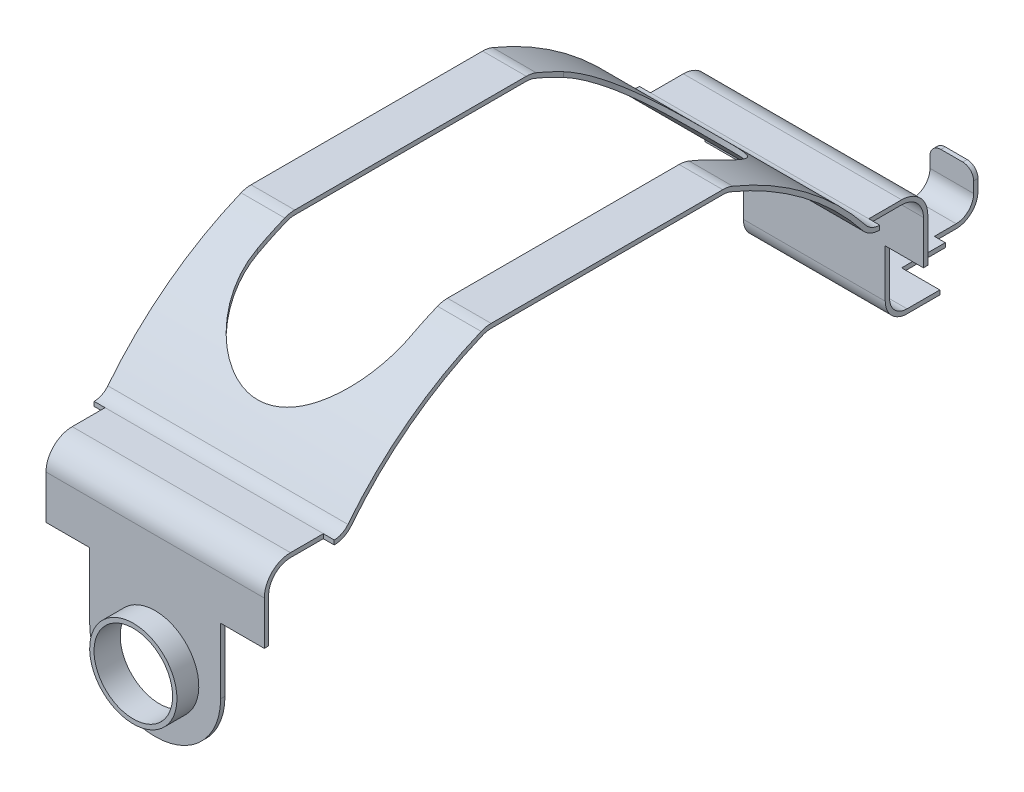
from build123d import *

# Parameters (mm, degrees)
EXTRUDE1_DEPTH     = 2.75
CUT_EXTRUDE1_DEPTH = 15.329956996
EXTRUDE2_DEPTH     = 2.5
EXTRUDE3_DEPTH     = 1.625
SKETCH8_W          = 1
SKETCH8_H          = 0.1
EXTRUDE4_DEPTH     = 0.75
EXTRUDE5_DEPTH     = 0.5
EXTRUDE6_DEPTH     = 0.1
SKETCH11_R         = 1
SKETCH11_R_2       = 0.9
EXTRUDE7_DEPTH     = 0.5
CUT_EXTRUDE2_REACH = 24.429
SKETCH12_R         = 0.9
FILLET1_R          = 0.25


with BuildPart() as part:
    # Sketch4 → Extrude1 (new, symmetric)
    with BuildSketch(Plane(origin=(0, 0, 0), x_dir=(0, 0, -1), z_dir=(1, 0, 0))):
        with BuildLine():
            Line((-2.652797108, 12.6), (2.652797108, 12.6))
            ThreePointArc((2.652797108, 12.6), (2.769316269, 12.58857734), (2.8813989, 12.554744284))
            ThreePointArc((2.8813989, 12.554744284), (4.555213838, 11.599383852), (5.933197614, 10.251967541))
            ThreePointArc((5.933197614, 10.251967541), (6.072675346, 10.139990984), (6.247012686, 10.1))
            Line((6.247012686, 10.1), (6.247012686, 10))
            ThreePointArc((6.247012686, 10), (6.029091011, 10.04998873), (5.854743846, 10.189959426))
            ThreePointArc((5.854743846, 10.189959426), (4.494980939, 11.519559057), (2.843298601, 12.462286904))
            ThreePointArc((2.843298601, 12.462286904), (2.749896409, 12.490481117), (2.652797108, 12.5))
            Line((2.652797108, 12.5), (-2.652797108, 12.5))
            ThreePointArc((-2.652797108, 12.5), (-2.749896409, 12.490481117), (-2.843298601, 12.462286904))
            ThreePointArc((-2.843298601, 12.462286904), (-4.494980939, 11.519559057), (-5.854743846, 10.189959426))
            ThreePointArc((-5.854743846, 10.189959426), (-6.029091011, 10.04998873), (-6.247012686, 10))
            Line((-6.247012686, 10), (-6.247012686, 10.1))
            ThreePointArc((-6.247012686, 10.1), (-6.072675346, 10.139990984), (-5.933197614, 10.251967541))
            ThreePointArc((-5.933197614, 10.251967541), (-4.555213838, 11.599383852), (-2.8813989, 12.554744284))
            ThreePointArc((-2.8813989, 12.554744284), (-2.769316269, 12.58857734), (-2.652797108, 12.6))
        make_face()
    extrude(amount=EXTRUDE1_DEPTH, both=True)

    # Sketch5 → Cut-Extrude1 (cut, through all)
    with BuildSketch(Plane(origin=(0, 0, 0), x_dir=(1, 0, 0), z_dir=(0, 1, 0))):
        with BuildLine():
            Line((1.75, -3.5), (1.75, 3.5))
            ThreePointArc((1.75, 3.5), (0, 5.25), (-1.75, 3.5))
            Line((-1.75, 3.5), (-1.75, -3.5))
            ThreePointArc((-1.75, -3.5), (0, -5.25), (1.75, -3.5))
        make_face()
    extrude(amount=CUT_EXTRUDE1_DEPTH, mode=Mode.SUBTRACT)

    # Sketch6 → Extrude2 (add, symmetric)
    with BuildSketch(Plane(origin=(0, 0, 0), x_dir=(0, 0, -1), z_dir=(1, 0, 0))):
        with BuildLine():
            Line((6.247012686, 10), (7, 10))
            ThreePointArc((7, 10), (7.353553391, 9.853553391), (7.5, 9.5))
            Line((7.5, 9.5), (7.5, 8.5))
            Line((7.5, 8.5), (7.6, 8.5))
            Line((7.6, 8.5), (7.6, 9.5))
            ThreePointArc((7.6, 9.5), (7.424264069, 9.924264069), (7, 10.1))
            Line((7, 10.1), (6.247012686, 10.1))
            Line((6.247012686, 10.1), (6.247012686, 10))
        make_face()
        with BuildLine():
            Line((-7.5, 8.5), (-7.6, 8.5))
            Line((-7.6, 8.5), (-7.6, 9.5))
            ThreePointArc((-7.6, 9.5), (-7.424264069, 9.924264069), (-7, 10.1))
            Line((-7, 10.1), (-6.247012686, 10.1))
            Line((-6.247012686, 10.1), (-6.247012686, 10))
            Line((-6.247012686, 10), (-7, 10))
            ThreePointArc((-7, 10), (-7.353553391, 9.853553391), (-7.5, 9.5))
            Line((-7.5, 9.5), (-7.5, 8.5))
        make_face()
    extrude(amount=EXTRUDE2_DEPTH, both=True)

    # Sketch7 → Extrude3 (add, symmetric)
    with BuildSketch(Plane(origin=(0, 0, 0), x_dir=(0, 0, -1), z_dir=(1, 0, 0))):
        with BuildLine():
            Line((7.5, 8.5), (7.5, 7.4))
            ThreePointArc((7.5, 7.4), (7.646446609, 7.046446609), (8, 6.9))
            Line((8, 6.9), (8.75, 6.9))
            Line((8.75, 6.9), (8.75, 7))
            Line((8.75, 7), (8, 7))
            ThreePointArc((8, 7), (7.717157288, 7.117157288), (7.6, 7.4))
            Line((7.6, 7.4), (7.6, 8.5))
            Line((7.6, 8.5), (7.5, 8.5))
        make_face()
    extrude(amount=EXTRUDE3_DEPTH, both=True)

    # Sketch8 → Extrude4 (add, symmetric)
    with BuildSketch(Plane(origin=(0, 0, 0), x_dir=(0, 0, -1), z_dir=(1, 0, 0))):
        with Locations((9.25, 6.95)):
            Rectangle(SKETCH8_W, SKETCH8_H)
    extrude(amount=EXTRUDE4_DEPTH, both=True)

    # Sketch9 → Extrude5 (add, symmetric)
    with BuildSketch(Plane(origin=(0, 0, 0), x_dir=(0, 0, -1), z_dir=(1, 0, 0))):
        with BuildLine():
            Line((10.75, 7.4), (10.75, 7.9))
            Line((10.75, 7.9), (10.65, 7.9))
            Line((10.65, 7.9), (10.65, 7.4))
            ThreePointArc((10.65, 7.4), (10.532842712, 7.117157288), (10.25, 7))
            Line((10.25, 7), (9.75, 7))
            Line((9.75, 7), (9.75, 6.9))
            Line((9.75, 6.9), (10.25, 6.9))
            ThreePointArc((10.25, 6.9), (10.603553391, 7.046446609), (10.75, 7.4))
        make_face()
    extrude(amount=EXTRUDE5_DEPTH, both=True)

    # Sketch10 → Extrude6 (add)
    with BuildSketch(Plane.XY.offset(7.5)):
        with BuildLine():
            Line((-1.5, 8.5), (-1.5, 7))
            ThreePointArc((-1.5, 7), (0, 5.5), (1.5, 7))
            Line((1.5, 7), (1.5, 8.5))
            Line((1.5, 8.5), (-1.5, 8.5))
        make_face()
    extrude(amount=EXTRUDE6_DEPTH)

    # Sketch11 → Extrude7 (add)
    with BuildSketch(Plane.XY.offset(7.6)):
        with Locations(Location((0, 7, 0), (0, 0, 90))):
            Circle(SKETCH11_R)
        with Locations((0, 7)):
            Circle(SKETCH11_R_2, mode=Mode.SUBTRACT)
    extrude(amount=EXTRUDE7_DEPTH)

    # Sketch12 → Cut-Extrude2 (cut, up to next)
    with BuildSketch(Plane.XY.offset(7.6), mode=Mode.PRIVATE) as cut_extrude2_sk1:
        with Locations((0, 7)):
            Circle(SKETCH12_R)
    cut_extrude2_tool1 = extrude(cut_extrude2_sk1.sketch, amount=-CUT_EXTRUDE2_REACH, mode=Mode.PRIVATE) & part.part
    add(cut_extrude2_tool1.solids().sort_by_distance((0, 7, 7.6))[0], mode=Mode.SUBTRACT)

    # Fillet1
    fillet1_edges = [part.edges().sort_by_distance(p)[0] for p in [
        (-0.5, 7.9, -10.7),
        (0.5, 7.9, -10.7),
    ]]
    fillet(fillet1_edges, radius=FILLET1_R)


solid = part.part
